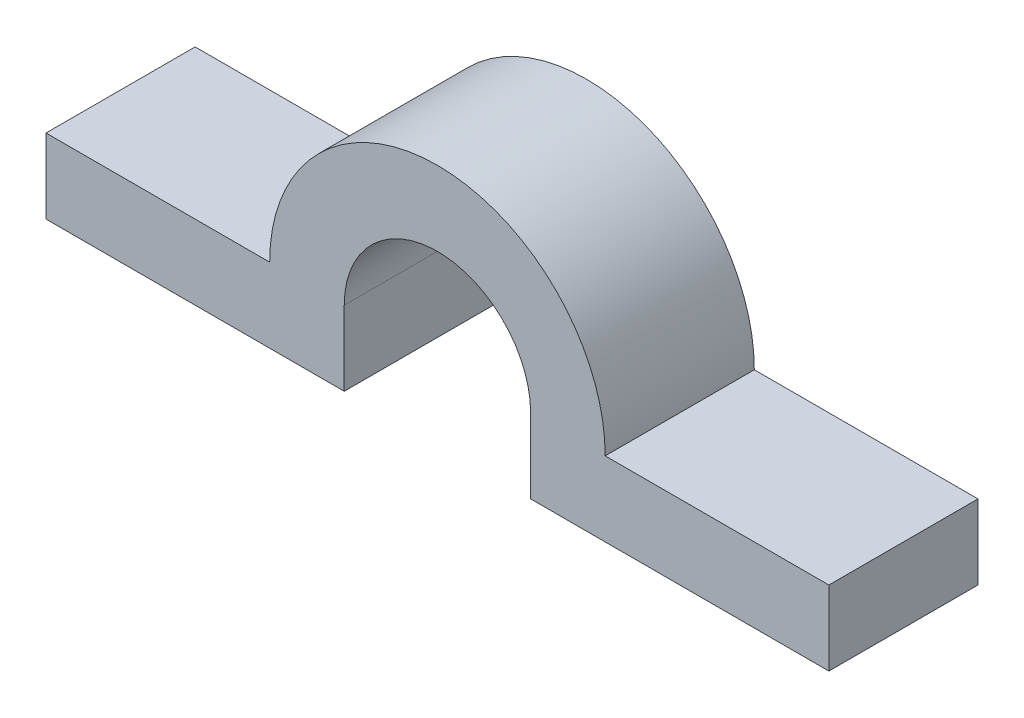
from build123d import *

# Parameters (mm, degrees)
BOSS_EXTRUDE1_DEPTH = 8


with BuildPart() as part:
    # Sketch2 → Boss-Extrude1 (new body)
    with BuildSketch(Plane.XY):
        with BuildLine():
            Line((0, -4), (8, -4))
            Line((8, -4), (8, 0))
            ThreePointArc((8, 0), (13, 5), (18, 0))
            Line((18, 0), (18, -4))
            Line((18, -4), (34, -4))
            Line((34, -4), (34, 0))
            Line((34, 0), (22, 0))
            ThreePointArc((22, 0), (13, 9), (4, 0))
            Line((4, 0), (-8, 0))
            Line((-8, 0), (-8, -4))
            Line((-8, -4), (0, -4))
        make_face()
    extrude(amount=BOSS_EXTRUDE1_DEPTH)


solid = part.part
